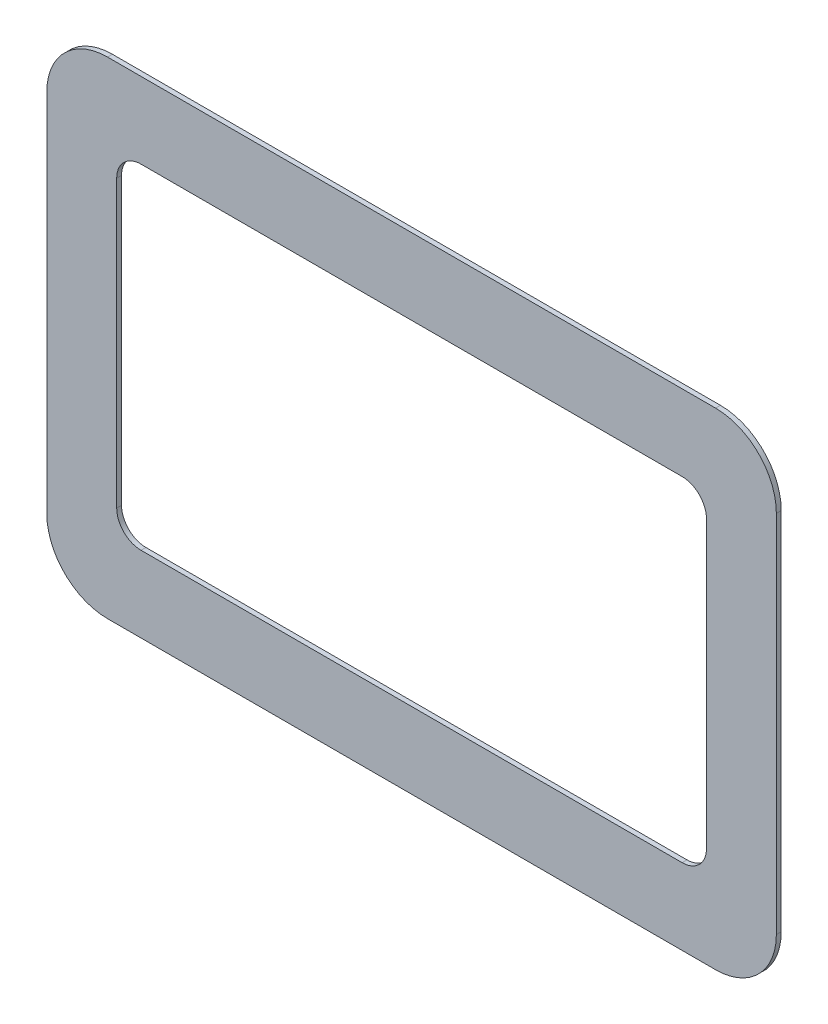
from build123d import *

# Parameters (mm, degrees)
BOSS_EXTRUDE1_DEPTH = 4
CUT_EXTRUDE4_DEPTH  = 4


with BuildPart() as part:
    # Sketch1 → Boss-Extrude1 (new body)
    with BuildSketch(Plane.XY):
        with BuildLine():
            Line((-210.293609009, -194.607906081), (289.706390991, -194.607906081))
            ThreePointArc((289.706390991, -194.607906081), (325.061730051, -179.96324514), (339.706390991, -144.607906081))
            Line((339.706390991, -144.607906081), (339.706390991, 155.392093919))
            ThreePointArc((339.706390991, 155.392093919), (325.061730051, 190.747432978), (289.706390991, 205.392093919))
            Line((289.706390991, 205.392093919), (-210.293609009, 205.392093919))
            ThreePointArc((-210.293609009, 205.392093919), (-245.648948068, 190.747432978), (-260.293609009, 155.392093919))
            Line((-260.293609009, 155.392093919), (-260.293609009, -144.607906081))
            ThreePointArc((-260.293609009, -144.607906081), (-245.648948068, -179.96324514), (-210.293609009, -194.607906081))
        make_face()
    extrude(amount=BOSS_EXTRUDE1_DEPTH)

    # Sketch3 → Cut-Extrude4 (cut)
    with BuildSketch(Plane.XY.offset(4)):
        with BuildLine():
            Line((-182.793609009, -132.107906081), (262.206390991, -132.107906081))
            ThreePointArc((262.206390991, -132.107906081), (276.348526615, -126.250041705), (282.206390991, -112.107906081))
            Line((282.206390991, -112.107906081), (282.206390991, 122.892093919))
            ThreePointArc((282.206390991, 122.892093919), (276.348526615, 137.034229543), (262.206390991, 142.892093919))
            Line((262.206390991, 142.892093919), (-182.793609009, 142.892093919))
            ThreePointArc((-182.793609009, 142.892093919), (-196.935744632, 137.034229543), (-202.793609009, 122.892093919))
            Line((-202.793609009, 122.892093919), (-202.793609009, -112.107906081))
            ThreePointArc((-202.793609009, -112.107906081), (-196.935744632, -126.250041705), (-182.793609009, -132.107906081))
        make_face()
    extrude(amount=-CUT_EXTRUDE4_DEPTH, mode=Mode.SUBTRACT)


solid = part.part
